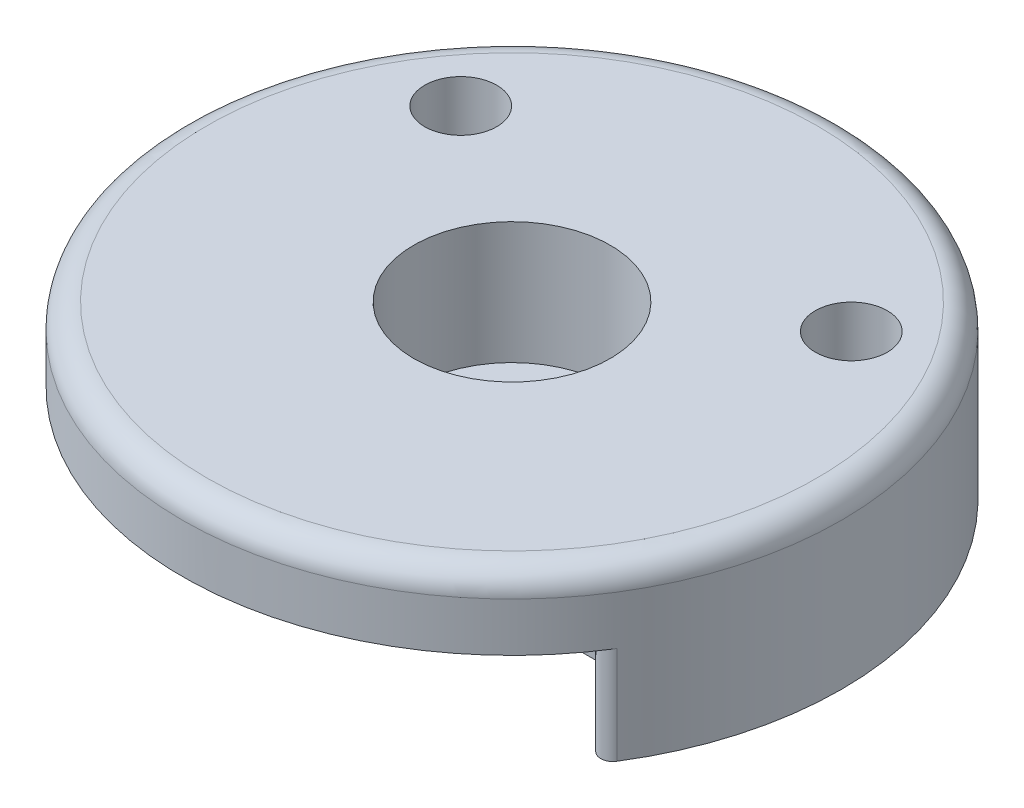
from build123d import *

# Parameters (mm, degrees)
SKETCH2_R               = 13.5
BOSS_EXTRUDE1_DEPTH     = 7
SKETCH3_R               = 4.025
CUT_EXTRUDE1_DEPTH      = 5
SKETCH4_W               = 21.05
SKETCH4_H               = 15.7
CUT_EXTRUDE2_DEPTH      = 1
SKETCH5_R               = 1.475
CUT_EXTRUDE3_DEPTH      = 6
FILLET1_R               = 1
CUT_EXTRUDE5_DEPTH      = 1
CUT_EXTRUDE5_DEPTH_BACK = 3
SKETCH6_W               = 21.05
SKETCH6_H               = 8.5
FILLET2_R               = 0.5


with BuildPart() as part:
    # Sketch2 → Boss-Extrude1 (new body)
    with BuildSketch(Plane(origin=(0, 0, 0), x_dir=(1, 0, 0), z_dir=(0, 1, 0))):
        with Locations(Location((0, 0, 0), (0, 0, 270))):
            Circle(SKETCH2_R)
    extrude(amount=BOSS_EXTRUDE1_DEPTH)

    # Sketch3 → Cut-Extrude1 (cut)
    with BuildSketch(Plane(origin=(0, 7, 0), x_dir=(1, 0, 0), z_dir=(0, 1, 0))):
        with Locations(Location((0, 0, 0), (0, 0, 270))):
            Circle(SKETCH3_R)
    extrude(amount=-CUT_EXTRUDE1_DEPTH, mode=Mode.SUBTRACT)

    # Sketch4 → Cut-Extrude2 (cut)
    with BuildSketch(Plane.XZ):
        Rectangle(SKETCH4_W, SKETCH4_H)
    extrude(amount=-CUT_EXTRUDE2_DEPTH, mode=Mode.SUBTRACT)

    # Sketch5 → Cut-Extrude3 (cut)
    with BuildSketch(Plane.XZ.offset(-1)):
        with Locations(Location((-8, -5.9, 0), (0, 0, 270))):
            Circle(SKETCH5_R)
        with Locations(Location((8, -5.9, 0), (0, 0, 270))):
            Circle(SKETCH5_R)
    extrude(amount=-CUT_EXTRUDE3_DEPTH, mode=Mode.SUBTRACT)

    # Fillet1
    fillet1_edges = [part.edges().sort_by_distance(p)[0] for p in [
        (0, 7, -13.5),
    ]]
    fillet(fillet1_edges, radius=FILLET1_R)

    # Sketch6 → Cut-Extrude5 (cut, two sides: drawn at the far end of the back side and taken through both)
    with BuildSketch(Plane.XZ.offset(-1).offset(-CUT_EXTRUDE5_DEPTH_BACK)):
        with Locations((0, 9.25)):
            Rectangle(SKETCH6_W, SKETCH6_H)
    extrude(amount=CUT_EXTRUDE5_DEPTH + CUT_EXTRUDE5_DEPTH_BACK, mode=Mode.SUBTRACT)

    # Fillet2
    fillet2_edges = [part.edges().sort_by_distance(p)[0] for p in [
        (-10.525, 2, 8.454251889),
        (10.525, 2, 8.454251889),
    ]]
    fillet(fillet2_edges, radius=FILLET2_R)


solid = part.part
